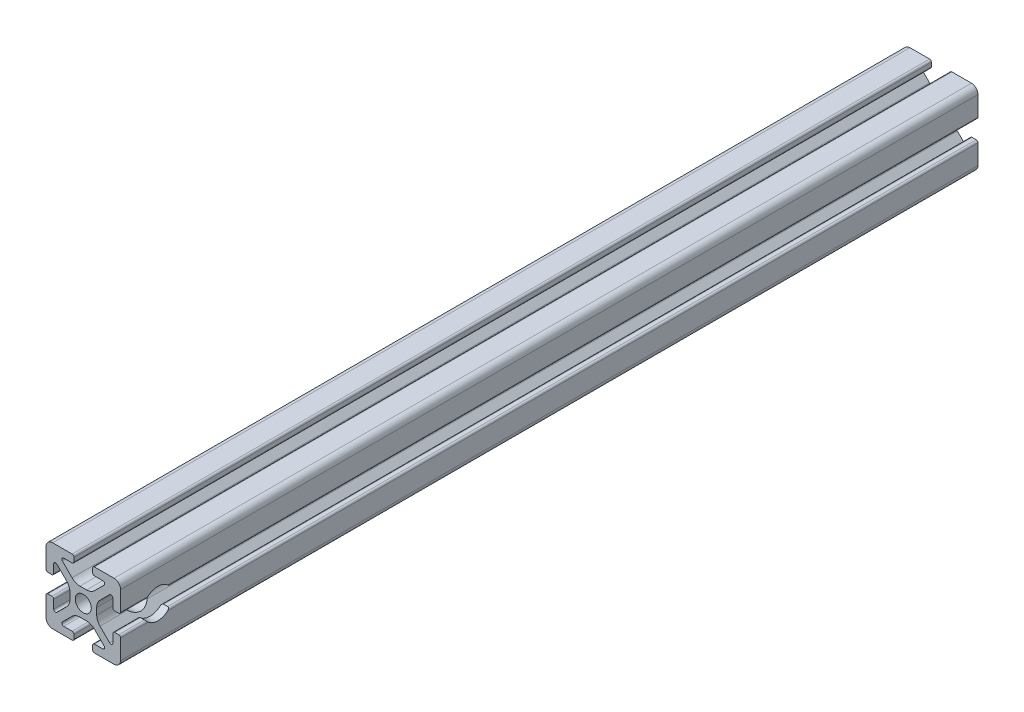
from build123d import *

# Parameters (mm, degrees)
BOSS_EXTRUDE1_DEPTH = 115
SKETCH5_R           = 4
CUT_EXTRUDE1_DEPTH  = 20


with BuildPart() as part:
    # Sketch4 → Boss-Extrude1 (new, symmetric)
    with BuildSketch(Plane.XY):
        with BuildLine():
            Line((3, -10), (8.25, -10))
            ThreePointArc((8.25, -10), (9.487436867, -9.487436867), (10, -8.25))
            Line((10, -8.25), (10, -3))
            ThreePointArc((10, -3), (9.853553391, -2.646446609), (9.5, -2.5))
            Line((9.5, -2.5), (8.424621202, -2.5))
            ThreePointArc((8.424621202, -2.5), (8.071067812, -2.646446609), (7.924621202, -3))
            Line((7.924621202, -3), (7.924621202, -5.25))
            ThreePointArc((7.924621202, -5.25), (7.615962919, -5.711939766), (7.071067812, -5.603553391))
            Line((7.071067812, -5.603553391), (4.478679656, -3.011165235))
            ThreePointArc((4.478679656, -3.011165235), (3.828361402, -2.037895189), (3.6, -0.889844892))
            Line((3.6, -0.889844892), (3.6, 0))
            Line((3.6, 0), (2.15, 0))
            ThreePointArc((2.15, 0), (1.52027958, -1.52027958), (0, -2.15))
            Line((0, -2.15), (0, -3.6))
            Line((0, -3.6), (0.889844892, -3.6))
            ThreePointArc((0.889844892, -3.6), (2.037895189, -3.828361402), (3.011165235, -4.478679656))
            Line((3.011165235, -4.478679656), (5.603553391, -7.071067812))
            ThreePointArc((5.603553391, -7.071067812), (5.711939766, -7.615962919), (5.25, -7.924621202))
            Line((5.25, -7.924621202), (3, -7.924621202))
            ThreePointArc((3, -7.924621202), (2.646446609, -8.071067812), (2.5, -8.424621202))
            Line((2.5, -8.424621202), (2.5, -9.5))
            ThreePointArc((2.5, -9.5), (2.646446609, -9.853553391), (3, -10))
        make_face()
    extrude(amount=BOSS_EXTRUDE1_DEPTH, both=True)

    # Mirror1: part across plane


with BuildPart() as part_1:
    add(part.part)
    add(part.part.mirror(Plane(origin=(0, 0, 0), x_dir=(0, 0, 1), z_dir=(1, 0, 0))))

    # Mirror2: part across plane


with BuildPart() as part_2:
    add(part_1.part)
    add(part_1.part.mirror(Plane.ZX))

    # Sketch5 → Cut-Extrude1 (cut)
    with BuildSketch(Plane.ZY.offset(10)):
        with Locations(Location((105, 0, 0), (0, 0, 228.832751655))):
            Circle(SKETCH5_R)
    extrude(amount=-CUT_EXTRUDE1_DEPTH, mode=Mode.SUBTRACT)


solid = part_2.part
